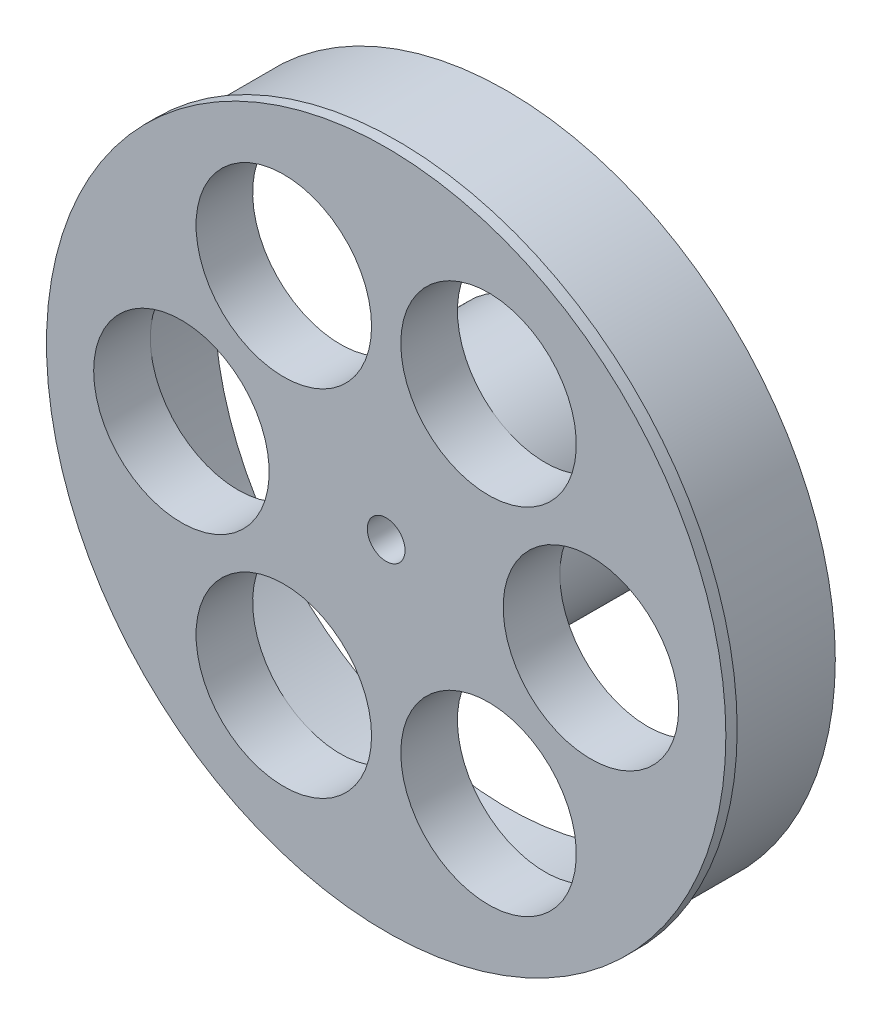
from build123d import *

# Parameters (mm, degrees)
CUT_EXTRUDE1_REACH = 15.467
SKETCH2_R          = 2.325
CIRPATTERN1_COUNT  = 6


with BuildPart() as part:
    # Sketch1 → Revolve1 (revolve)
    with BuildSketch(Plane(origin=(0, 0, 0), x_dir=(0, 0, -1), z_dir=(1, 0, 0)), mode=Mode.PRIVATE) as revolve1_sk:
        Polygon((1.5, 3.1), (4.4, 3.1), (4.4, 2.1), (2.3, 2.1), (2.3, 0.5), (0, 0.5), (0, 9), (0.3, 9), (0.3, 8.7), (3.2, 8.7), (3.2, 7.75), (1.5, 7.75), align=None)
    revolve(revolve1_sk.sketch.rotate(Axis((0, 0, 59.838000458), (0, 0, -1)), 90), axis=Axis((0, 0, 59.838000458), (0, 0, -1)))

    # Sketch2 → Cut-Extrude1 (cut, up to next)
    with BuildSketch(Plane.XY, mode=Mode.PRIVATE) as cut_extrude1_sk1:
        with Locations((5.425, 0)):
            Circle(SKETCH2_R)
    cut_extrude1_tool1 = extrude(cut_extrude1_sk1.sketch, amount=-CUT_EXTRUDE1_REACH, mode=Mode.PRIVATE) & part.part
    cut_extrude1 = cut_extrude1_tool1.solids().sort_by_distance((5.425, 0, 0))[0]
    add(cut_extrude1, mode=Mode.SUBTRACT)

    # CirPattern1: Cut-Extrude1 ×6 about axis
    cirpattern1_axis = Axis((0, 0, 0), (0, 0, 1))
    for i in range(1, CIRPATTERN1_COUNT):
        add(cut_extrude1.rotate(cirpattern1_axis, i * 360 / CIRPATTERN1_COUNT), mode=Mode.SUBTRACT)


solid = part.part
